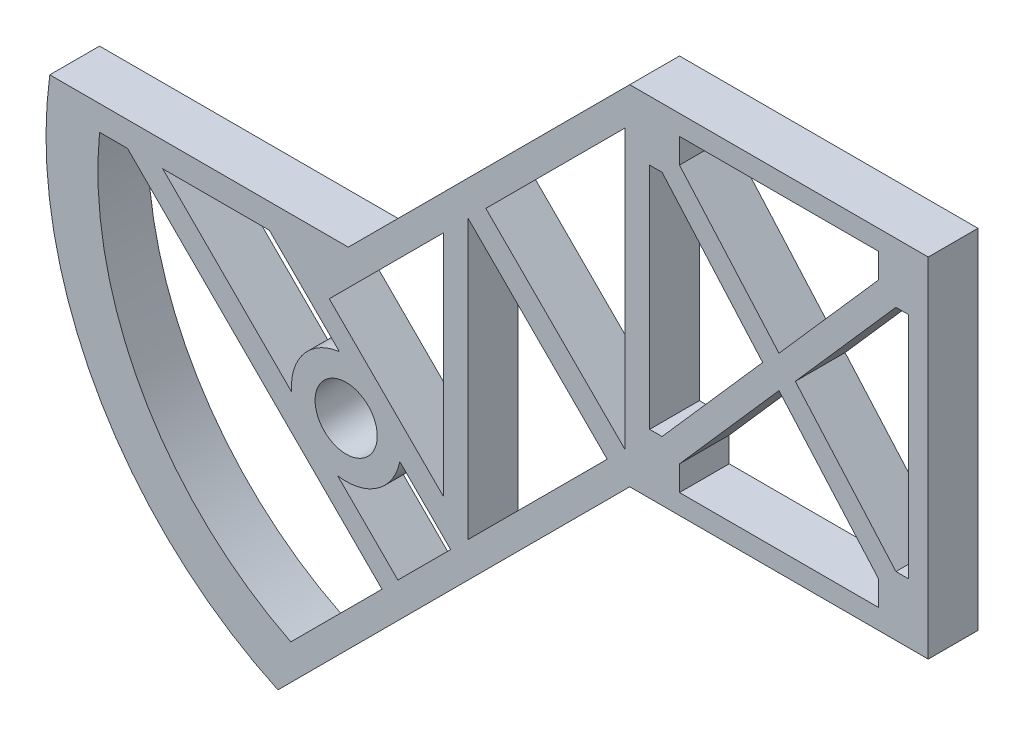
from build123d import *

# Parameters (mm, degrees)
BOSS_EXTRUDE1_DEPTH = 12.7
SKETCH2_R           = 7.9375
CUT_EXTRUDE1_DEPTH  = 25.4
CUT_EXTRUDE2_DEPTH  = 25.4
CUT_EXTRUDE3_DEPTH  = 25.4
CUT_EXTRUDE4_DEPTH  = 25.4
CUT_EXTRUDE5_DEPTH  = 25.4


with BuildPart() as part:
    # Sketch1 → Boss-Extrude1 (new body)
    with BuildSketch(Plane.XY):
        with BuildLine():
            Line((29.67833379, 155.20549492), (-42.163715178, 83.363445951))
            Line((-42.163715178, 83.363445951), (-118.363715178, 83.363445951))
            ThreePointArc((-118.363715178, 83.363445951), (-106.853658004, 20.335826766), (-60.124227421, -23.497066291))
            Line((-60.124227421, -23.497066291), (29.67833379, 66.30549492))
            Line((29.67833379, 66.30549492), (105.87833379, 66.30549492))
            Line((105.87833379, 66.30549492), (105.87833379, 155.20549492))
            Line((105.87833379, 155.20549492), (29.67833379, 155.20549492))
        make_face()
    extrude(amount=BOSS_EXTRUDE1_DEPTH)

    # Sketch2 → Cut-Extrude1 (cut)
    with BuildSketch(Plane.XY.offset(12.7)):
        with Locations((-42.71166621, 45.263445951)):
            Circle(SKETCH2_R)
    extrude(amount=-CUT_EXTRUDE1_DEPTH, mode=Mode.SUBTRACT)

    # Sketch3 → Cut-Extrude2 (cut)
    with BuildSketch(Plane.XY.offset(12.7)):
        Polygon((93.17833379, 143.77549492), (67.77833379, 114.880205391), (42.37833379, 143.77549492), (42.37833379, 150.12549492), (93.17833379, 150.12549492), align=None)
        Polygon((97.62333379, 139.96549492), (71.946691953, 110.75549492), (97.62333379, 81.54549492), (100.79833379, 81.54549492), (100.79833379, 139.96549492), align=None)
        Polygon((34.75833379, 139.96549492), (37.93333379, 139.96549492), (63.609975627, 110.75549492), (37.93333379, 81.54549492), (34.75833379, 81.54549492), align=None)
        Polygon((42.37833379, 71.38549492), (42.37833379, 77.73549492), (67.77833379, 106.630784448), (93.17833379, 77.73549492), (93.17833379, 71.38549492), align=None)
    extrude(amount=-CUT_EXTRUDE2_DEPTH, mode=Mode.SUBTRACT)

    # Sketch4 → Cut-Extrude3 (cut)
    with BuildSketch(Plane.XY.offset(12.7)):
        Polygon((-7.061410089, 109.48549492), (28.40833379, 74.015751041), (28.40833379, 144.955238799), align=None)
        Polygon((23.91820573, 69.52562298), (-11.551538149, 34.055879101), (-11.551538149, 104.995366859), align=None)
        Polygon((-17.901538149, 98.645366859), (-47.021282028, 69.52562298), (-17.901538149, 40.405879101), align=None)
    extrude(amount=-CUT_EXTRUDE3_DEPTH, mode=Mode.SUBTRACT)

    # Sketch5 → Cut-Extrude4 (cut)
    with BuildSketch(Plane.XY.offset(12.7)):
        with BuildLine():
            Line((-29.010735503, 42.534820334), (-16.04166621, 29.565751041))
            Line((-16.04166621, 29.565751041), (-29.512050392, 16.095366859))
            Line((-29.512050392, 16.095366859), (-44.879327107, 31.462643575))
            ThreePointArc((-44.879327107, 31.462643575), (-34.717771497, 33.806633684), (-29.010735503, 42.534820334))
        make_face()
        with BuildLine():
            Line((-44.434025607, 59.126864653), (-62.320606906, 77.013445951))
            Line((-62.320606906, 77.013445951), (-89.539393744, 77.013445951))
            Line((-89.539393744, 77.013445951), (-56.633788009, 44.107840216))
            ThreePointArc((-56.633788009, 44.107840216), (-53.555107626, 54.071435408), (-44.434025607, 59.126864653))
        make_face()
    extrude(amount=-CUT_EXTRUDE4_DEPTH, mode=Mode.SUBTRACT)

    # Sketch6 → Cut-Extrude5 (cut)
    with BuildSketch(Plane.XY.offset(12.7)):
        with BuildLine():
            Line((-56.837225548, -11.229808297), (-33.556810582, 12.050606669))
            Line((-33.556810582, 12.050606669), (-98.519649865, 77.013445951))
            Line((-98.519649865, 77.013445951), (-105.663715178, 77.013445951))
            ThreePointArc((-105.663715178, 77.013445951), (-94.97435542, 25.298160398), (-56.837225548, -11.229808297))
        make_face()
    extrude(amount=-CUT_EXTRUDE5_DEPTH, mode=Mode.SUBTRACT)


solid = part.part
